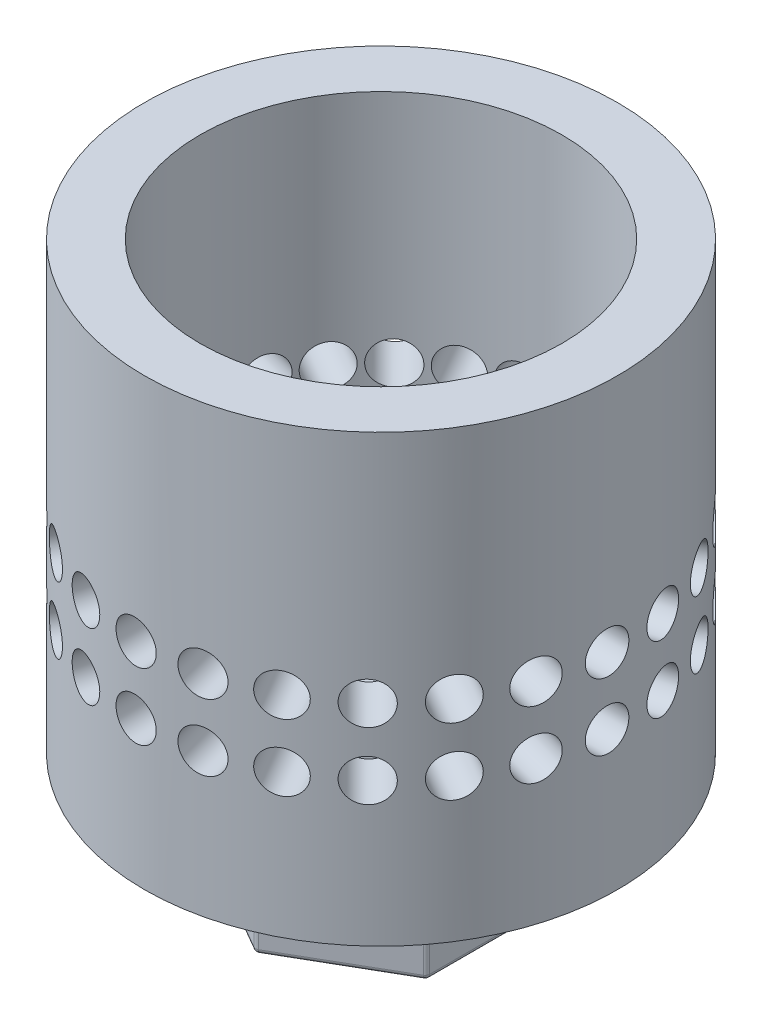
from build123d import *

# Parameters (mm, degrees)
SKETCH1_R                   = 13.5
BOSS_EXTRUDE1_DEPTH         = 25.4
F_7_8_14_TAPPED_HOLE1_D     = 20.6375
F_7_8_14_TAPPED_HOLE1_DEPTH = 19.05
F_7_8_14_TAPPED_HOLE1_TIP   = 6.200130513
BOSS_EXTRUDE2_DEPTH         = 6.35
FILLET1_R                   = 0.254
SKETCH7_R                   = 1.19585469
CUT_EXTRUDE1_DEPTH          = 32.775147521
CIRPATTERN1_COUNT           = 24
LPATTERN1_COUNT             = 2
LPATTERN1_PITCH             = 3.81
LPATTERN1_COPY_1_SKETCH_R   = 1.19585469
LPATTERN1_COPY_1_DEPTH      = 32.775147521
LPATTERN1_COPY_2_SKETCH_R   = 1.19585469
LPATTERN1_COPY_2_DEPTH      = 32.775147521
LPATTERN1_COPY_3_SKETCH_R   = 1.19585469
LPATTERN1_COPY_3_DEPTH      = 32.775147521
LPATTERN1_COPY_4_SKETCH_R   = 1.19585469
LPATTERN1_COPY_4_DEPTH      = 32.775147521
LPATTERN1_COPY_5_SKETCH_R   = 1.19585469
LPATTERN1_COPY_5_DEPTH      = 32.775147521
LPATTERN1_COPY_6_SKETCH_R   = 1.19585469
LPATTERN1_COPY_6_DEPTH      = 32.775147521
LPATTERN1_COPY_7_SKETCH_R   = 1.19585469
LPATTERN1_COPY_7_DEPTH      = 32.775147521
LPATTERN1_COPY_8_SKETCH_R   = 1.19585469
LPATTERN1_COPY_8_DEPTH      = 32.775147521
LPATTERN1_COPY_9_SKETCH_R   = 1.19585469
LPATTERN1_COPY_9_DEPTH      = 32.775147521
LPATTERN1_COPY_10_SKETCH_R  = 1.19585469
LPATTERN1_COPY_10_DEPTH     = 32.775147521
LPATTERN1_COPY_11_SKETCH_R  = 1.19585469
LPATTERN1_COPY_11_DEPTH     = 32.775147521
LPATTERN1_COPY_12_SKETCH_R  = 1.19585469
LPATTERN1_COPY_12_DEPTH     = 32.775147521
LPATTERN1_COPY_13_SKETCH_R  = 1.19585469
LPATTERN1_COPY_13_DEPTH     = 32.775147521
LPATTERN1_COPY_14_SKETCH_R  = 1.19585469
LPATTERN1_COPY_14_DEPTH     = 32.775147521
LPATTERN1_COPY_15_SKETCH_R  = 1.19585469
LPATTERN1_COPY_15_DEPTH     = 32.775147521
LPATTERN1_COPY_16_SKETCH_R  = 1.19585469
LPATTERN1_COPY_16_DEPTH     = 32.775147521
LPATTERN1_COPY_17_SKETCH_R  = 1.19585469
LPATTERN1_COPY_17_DEPTH     = 32.775147521
LPATTERN1_COPY_18_SKETCH_R  = 1.19585469
LPATTERN1_COPY_18_DEPTH     = 32.775147521
LPATTERN1_COPY_19_SKETCH_R  = 1.19585469
LPATTERN1_COPY_19_DEPTH     = 32.775147521
LPATTERN1_COPY_20_SKETCH_R  = 1.19585469
LPATTERN1_COPY_20_DEPTH     = 32.775147521
LPATTERN1_COPY_21_SKETCH_R  = 1.19585469
LPATTERN1_COPY_21_DEPTH     = 32.775147521
LPATTERN1_COPY_22_SKETCH_R  = 1.19585469
LPATTERN1_COPY_22_DEPTH     = 32.775147521
LPATTERN1_COPY_23_SKETCH_R  = 1.19585469
LPATTERN1_COPY_23_DEPTH     = 32.775147521


with BuildPart() as part:
    # Sketch1 → Boss-Extrude1 (new body)
    with BuildSketch(Plane(origin=(0, 0, 0), x_dir=(1, 0, 0), z_dir=(0, 1, 0))):
        with Locations(Location((0, 0, 0), (0, 0, 270))):
            Circle(SKETCH1_R)
    extrude(amount=BOSS_EXTRUDE1_DEPTH)

    # 7/8-14 Tapped Hole1
    with Locations(Plane(origin=(0, 25.4, 0), x_dir=(1, 0, 0), z_dir=(0, 1, 0))):
        with Locations((0, 0)):
            Hole(F_7_8_14_TAPPED_HOLE1_D / 2, depth=F_7_8_14_TAPPED_HOLE1_DEPTH)
            with Locations((0, 0, -(F_7_8_14_TAPPED_HOLE1_DEPTH + F_7_8_14_TAPPED_HOLE1_TIP / 2))):  # 118° drill point
                Cone(0, F_7_8_14_TAPPED_HOLE1_D / 2, F_7_8_14_TAPPED_HOLE1_TIP, mode=Mode.SUBTRACT)

    # Sketch6 → Boss-Extrude2 (add)
    with BuildSketch(Plane.XZ):
        Polygon((6.223, 3.592850725), (0, 7.18570145), (-6.223, 3.592850725), (-6.223, -3.592850725), (0, -7.18570145), (6.223, -3.592850725), align=None)
    extrude(amount=BOSS_EXTRUDE2_DEPTH)

    # Fillet1
    fillet1_edges = [part.edges().sort_by_distance(p)[0] for p in [
        (6.223, 0, 0),
        (6.223, -3.175, -3.592850725),
        (3.1115, 0, 5.389276088),
        (6.223, -3.175, 3.592850725),
        (-3.1115, 0, 5.389276088),
        (0, -3.175, 7.18570145),
        (-6.223, 0, 0),
        (-6.223, -3.175, 3.592850725),
        (-3.1115, 0, -5.389276088),
        (-6.223, -3.175, -3.592850725),
        (3.1115, 0, -5.389276088),
        (0, -3.175, -7.18570145),
        (6.223, -6.35, 0),
        (3.1115, -6.35, 5.389276088),
        (-3.1115, -6.35, 5.389276088),
        (-6.223, -6.35, 0),
        (-3.1115, -6.35, -5.389276088),
        (3.1115, -6.35, -5.389276088),
    ]]
    fillet(fillet1_edges, radius=FILLET1_R)

    # Sketch7 → Cut-Extrude1 (cut, through all)
    with BuildSketch(Plane.XY):
        with Locations((0.536072792, 8.18481802)):
            Circle(SKETCH7_R)
    cut_extrude1 = extrude(amount=-CUT_EXTRUDE1_DEPTH, mode=Mode.SUBTRACT)

    # CirPattern1: Cut-Extrude1 ×24 about axis
    cirpattern1_axis = Axis((0, 25.4, 0), (0, -1, 0))
    for i in range(1, CIRPATTERN1_COUNT):
        add(cut_extrude1.rotate(cirpattern1_axis, i * 360 / CIRPATTERN1_COUNT), mode=Mode.SUBTRACT)

    # LPattern1: Cut-Extrude1 ×2
    with Locations(*[(0, i * LPATTERN1_PITCH, 0) for i in range(1, LPATTERN1_COUNT)]):
        add(cut_extrude1, mode=Mode.SUBTRACT)

    # LPattern1 copy 1 sketch → LPattern1 copy 1 (cut, through all)
    with BuildSketch(Plane(origin=(0, 3.81, 0), x_dir=(0.9659258262890683, 0, 0.25881904510252074), z_dir=(-0.25881904510252074, 0, 0.9659258262890683))):
        with Locations((0.536072792, 8.18481802)):
            Circle(LPATTERN1_COPY_1_SKETCH_R)
    extrude(amount=-LPATTERN1_COPY_1_DEPTH, mode=Mode.SUBTRACT)

    # LPattern1 copy 2 sketch → LPattern1 copy 2 (cut, through all)
    with BuildSketch(Plane(origin=(0, 3.81, 0), x_dir=(0.8660254037844387, 0, 0.49999999999999994), z_dir=(-0.49999999999999994, 0, 0.8660254037844387))):
        with Locations((0.536072792, 8.18481802)):
            Circle(LPATTERN1_COPY_2_SKETCH_R)
    extrude(amount=-LPATTERN1_COPY_2_DEPTH, mode=Mode.SUBTRACT)

    # LPattern1 copy 3 sketch → LPattern1 copy 3 (cut, through all)
    with BuildSketch(Plane(origin=(0, 3.81, 0), x_dir=(0.7071067811865476, 0, 0.7071067811865475), z_dir=(-0.7071067811865475, 0, 0.7071067811865476))):
        with Locations((0.536072792, 8.18481802)):
            Circle(LPATTERN1_COPY_3_SKETCH_R)
    extrude(amount=-LPATTERN1_COPY_3_DEPTH, mode=Mode.SUBTRACT)

    # LPattern1 copy 4 sketch → LPattern1 copy 4 (cut, through all)
    with BuildSketch(Plane(origin=(0, 3.81, 0), x_dir=(0.5000000000000001, 0, 0.8660254037844386), z_dir=(-0.8660254037844386, 0, 0.5000000000000001))):
        with Locations((0.536072792, 8.18481802)):
            Circle(LPATTERN1_COPY_4_SKETCH_R)
    extrude(amount=-LPATTERN1_COPY_4_DEPTH, mode=Mode.SUBTRACT)

    # LPattern1 copy 5 sketch → LPattern1 copy 5 (cut, through all)
    with BuildSketch(Plane(origin=(0, 3.81, 0), x_dir=(0.25881904510252074, 0, 0.9659258262890683), z_dir=(-0.9659258262890683, 0, 0.25881904510252074))):
        with Locations((0.536072792, 8.18481802)):
            Circle(LPATTERN1_COPY_5_SKETCH_R)
    extrude(amount=-LPATTERN1_COPY_5_DEPTH, mode=Mode.SUBTRACT)

    # LPattern1 copy 6 sketch → LPattern1 copy 6 (cut, through all)
    with BuildSketch(Plane(origin=(0, 3.81, 0), x_dir=(0, 0, 1), z_dir=(-1, 0, 0))):
        with Locations((0.536072792, 8.18481802)):
            Circle(LPATTERN1_COPY_6_SKETCH_R)
    extrude(amount=-LPATTERN1_COPY_6_DEPTH, mode=Mode.SUBTRACT)

    # LPattern1 copy 7 sketch → LPattern1 copy 7 (cut, through all)
    with BuildSketch(Plane(origin=(0, 3.81, 0), x_dir=(-0.25881904510252085, 0, 0.9659258262890683), z_dir=(-0.9659258262890683, 0, -0.25881904510252085))):
        with Locations((0.536072792, 8.18481802)):
            Circle(LPATTERN1_COPY_7_SKETCH_R)
    extrude(amount=-LPATTERN1_COPY_7_DEPTH, mode=Mode.SUBTRACT)

    # LPattern1 copy 8 sketch → LPattern1 copy 8 (cut, through all)
    with BuildSketch(Plane(origin=(0, 3.81, 0), x_dir=(-0.4999999999999998, 0, 0.8660254037844387), z_dir=(-0.8660254037844387, 0, -0.4999999999999998))):
        with Locations((0.536072792, 8.18481802)):
            Circle(LPATTERN1_COPY_8_SKETCH_R)
    extrude(amount=-LPATTERN1_COPY_8_DEPTH, mode=Mode.SUBTRACT)

    # LPattern1 copy 9 sketch → LPattern1 copy 9 (cut, through all)
    with BuildSketch(Plane(origin=(0, 3.81, 0), x_dir=(-0.7071067811865475, 0, 0.7071067811865476), z_dir=(-0.7071067811865476, 0, -0.7071067811865475))):
        with Locations((0.536072792, 8.18481802)):
            Circle(LPATTERN1_COPY_9_SKETCH_R)
    extrude(amount=-LPATTERN1_COPY_9_DEPTH, mode=Mode.SUBTRACT)

    # LPattern1 copy 10 sketch → LPattern1 copy 10 (cut, through all)
    with BuildSketch(Plane(origin=(0, 3.81, 0), x_dir=(-0.8660254037844387, 0, 0.49999999999999994), z_dir=(-0.49999999999999994, 0, -0.8660254037844387))):
        with Locations((0.536072792, 8.18481802)):
            Circle(LPATTERN1_COPY_10_SKETCH_R)
    extrude(amount=-LPATTERN1_COPY_10_DEPTH, mode=Mode.SUBTRACT)

    # LPattern1 copy 11 sketch → LPattern1 copy 11 (cut, through all)
    with BuildSketch(Plane(origin=(0, 3.81, 0), x_dir=(-0.9659258262890682, 0, 0.258819045102521), z_dir=(-0.258819045102521, 0, -0.9659258262890682))):
        with Locations((0.536072792, 8.18481802)):
            Circle(LPATTERN1_COPY_11_SKETCH_R)
    extrude(amount=-LPATTERN1_COPY_11_DEPTH, mode=Mode.SUBTRACT)

    # LPattern1 copy 12 sketch → LPattern1 copy 12 (cut, through all)
    with BuildSketch(Plane(origin=(0, 3.81, 0), x_dir=(-1, 0, 0), z_dir=(0, 0, -1))):
        with Locations((0.536072792, 8.18481802)):
            Circle(LPATTERN1_COPY_12_SKETCH_R)
    extrude(amount=-LPATTERN1_COPY_12_DEPTH, mode=Mode.SUBTRACT)

    # LPattern1 copy 13 sketch → LPattern1 copy 13 (cut, through all)
    with BuildSketch(Plane(origin=(0, 3.81, 0), x_dir=(-0.9659258262890683, 0, -0.2588190451025208), z_dir=(0.2588190451025208, 0, -0.9659258262890683))):
        with Locations((0.536072792, 8.18481802)):
            Circle(LPATTERN1_COPY_13_SKETCH_R)
    extrude(amount=-LPATTERN1_COPY_13_DEPTH, mode=Mode.SUBTRACT)

    # LPattern1 copy 14 sketch → LPattern1 copy 14 (cut, through all)
    with BuildSketch(Plane(origin=(0, 3.81, 0), x_dir=(-0.8660254037844386, 0, -0.5000000000000001), z_dir=(0.5000000000000001, 0, -0.8660254037844386))):
        with Locations((0.536072792, 8.18481802)):
            Circle(LPATTERN1_COPY_14_SKETCH_R)
    extrude(amount=-LPATTERN1_COPY_14_DEPTH, mode=Mode.SUBTRACT)

    # LPattern1 copy 15 sketch → LPattern1 copy 15 (cut, through all)
    with BuildSketch(Plane(origin=(0, 3.81, 0), x_dir=(-0.7071067811865477, 0, -0.7071067811865475), z_dir=(0.7071067811865475, 0, -0.7071067811865477))):
        with Locations((0.536072792, 8.18481802)):
            Circle(LPATTERN1_COPY_15_SKETCH_R)
    extrude(amount=-LPATTERN1_COPY_15_DEPTH, mode=Mode.SUBTRACT)

    # LPattern1 copy 16 sketch → LPattern1 copy 16 (cut, through all)
    with BuildSketch(Plane(origin=(0, 3.81, 0), x_dir=(-0.5000000000000004, 0, -0.8660254037844384), z_dir=(0.8660254037844384, 0, -0.5000000000000004))):
        with Locations((0.536072792, 8.18481802)):
            Circle(LPATTERN1_COPY_16_SKETCH_R)
    extrude(amount=-LPATTERN1_COPY_16_DEPTH, mode=Mode.SUBTRACT)

    # LPattern1 copy 17 sketch → LPattern1 copy 17 (cut, through all)
    with BuildSketch(Plane(origin=(0, 3.81, 0), x_dir=(-0.25881904510252063, 0, -0.9659258262890683), z_dir=(0.9659258262890683, 0, -0.25881904510252063))):
        with Locations((0.536072792, 8.18481802)):
            Circle(LPATTERN1_COPY_17_SKETCH_R)
    extrude(amount=-LPATTERN1_COPY_17_DEPTH, mode=Mode.SUBTRACT)

    # LPattern1 copy 18 sketch → LPattern1 copy 18 (cut, through all)
    with BuildSketch(Plane(origin=(0, 3.81, 0), x_dir=(0, 0, -1), z_dir=(1, 0, 0))):
        with Locations((0.536072792, 8.18481802)):
            Circle(LPATTERN1_COPY_18_SKETCH_R)
    extrude(amount=-LPATTERN1_COPY_18_DEPTH, mode=Mode.SUBTRACT)

    # LPattern1 copy 19 sketch → LPattern1 copy 19 (cut, through all)
    with BuildSketch(Plane(origin=(0, 3.81, 0), x_dir=(0.2588190451025203, 0, -0.9659258262890684), z_dir=(0.9659258262890684, 0, 0.2588190451025203))):
        with Locations((0.536072792, 8.18481802)):
            Circle(LPATTERN1_COPY_19_SKETCH_R)
    extrude(amount=-LPATTERN1_COPY_19_DEPTH, mode=Mode.SUBTRACT)

    # LPattern1 copy 20 sketch → LPattern1 copy 20 (cut, through all)
    with BuildSketch(Plane(origin=(0, 3.81, 0), x_dir=(0.5000000000000001, 0, -0.8660254037844386), z_dir=(0.8660254037844386, 0, 0.5000000000000001))):
        with Locations((0.536072792, 8.18481802)):
            Circle(LPATTERN1_COPY_20_SKETCH_R)
    extrude(amount=-LPATTERN1_COPY_20_DEPTH, mode=Mode.SUBTRACT)

    # LPattern1 copy 21 sketch → LPattern1 copy 21 (cut, through all)
    with BuildSketch(Plane(origin=(0, 3.81, 0), x_dir=(0.7071067811865474, 0, -0.7071067811865477), z_dir=(0.7071067811865477, 0, 0.7071067811865474))):
        with Locations((0.536072792, 8.18481802)):
            Circle(LPATTERN1_COPY_21_SKETCH_R)
    extrude(amount=-LPATTERN1_COPY_21_DEPTH, mode=Mode.SUBTRACT)

    # LPattern1 copy 22 sketch → LPattern1 copy 22 (cut, through all)
    with BuildSketch(Plane(origin=(0, 3.81, 0), x_dir=(0.8660254037844384, 0, -0.5000000000000004), z_dir=(0.5000000000000004, 0, 0.8660254037844384))):
        with Locations((0.536072792, 8.18481802)):
            Circle(LPATTERN1_COPY_22_SKETCH_R)
    extrude(amount=-LPATTERN1_COPY_22_DEPTH, mode=Mode.SUBTRACT)

    # LPattern1 copy 23 sketch → LPattern1 copy 23 (cut, through all)
    with BuildSketch(Plane(origin=(0, 3.81, 0), x_dir=(0.9659258262890683, 0, -0.2588190451025207), z_dir=(0.2588190451025207, 0, 0.9659258262890683))):
        with Locations((0.536072792, 8.18481802)):
            Circle(LPATTERN1_COPY_23_SKETCH_R)
    extrude(amount=-LPATTERN1_COPY_23_DEPTH, mode=Mode.SUBTRACT)


solid = part.part
